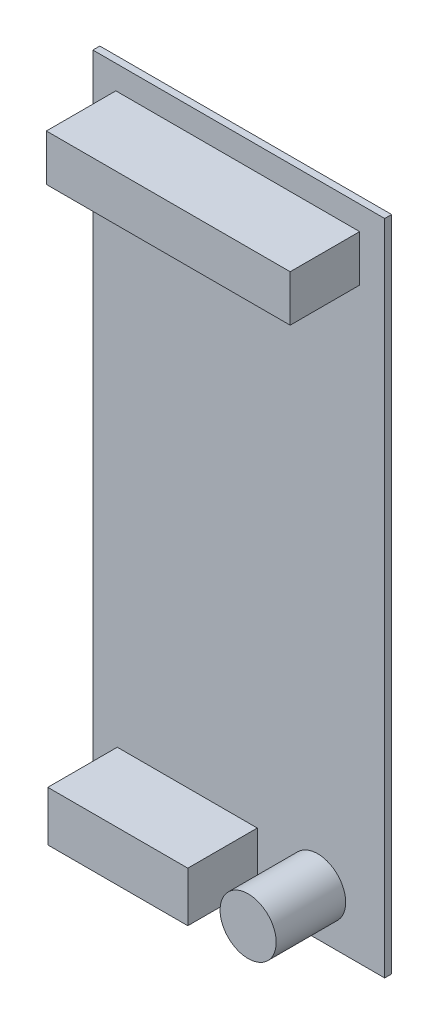
from build123d import *

# Parameters (mm, degrees)
SKETCH1_W           = 63
SKETCH1_H           = 142
BOSS_EXTRUDE1_DEPTH = 0.75
SKETCH2_W           = 52.632852527
SKETCH2_H           = 10
BOSS_EXTRUDE2_DEPTH = 15
SKETCH3_R           = 6.05981783
SKETCH3_W           = 30.224806401
SKETCH3_H           = 10.769758603
BOSS_EXTRUDE3_DEPTH = 15


with BuildPart() as part:
    # Sketch1 → Boss-Extrude1 (new, symmetric)
    with BuildSketch(Plane.XY):
        Rectangle(SKETCH1_W, SKETCH1_H)
    extrude(amount=BOSS_EXTRUDE1_DEPTH, both=True)

    # Sketch2 → Boss-Extrude2 (add)
    with BuildSketch(Plane.XY.offset(0.75)):
        with Locations((-0.219961356, 60.846409529)):
            Rectangle(SKETCH2_W, SKETCH2_H)
    extrude(amount=BOSS_EXTRUDE2_DEPTH)

    # Sketch3 → Boss-Extrude3 (add)
    with BuildSketch(Plane.XY.offset(0.75)):
        with Locations((17.023166824, -61.057583047)):
            Circle(SKETCH3_R)
        with Locations((-11.11717017, -62.099817751)):
            Rectangle(SKETCH3_W, SKETCH3_H)
    extrude(amount=BOSS_EXTRUDE3_DEPTH)


solid = part.part
